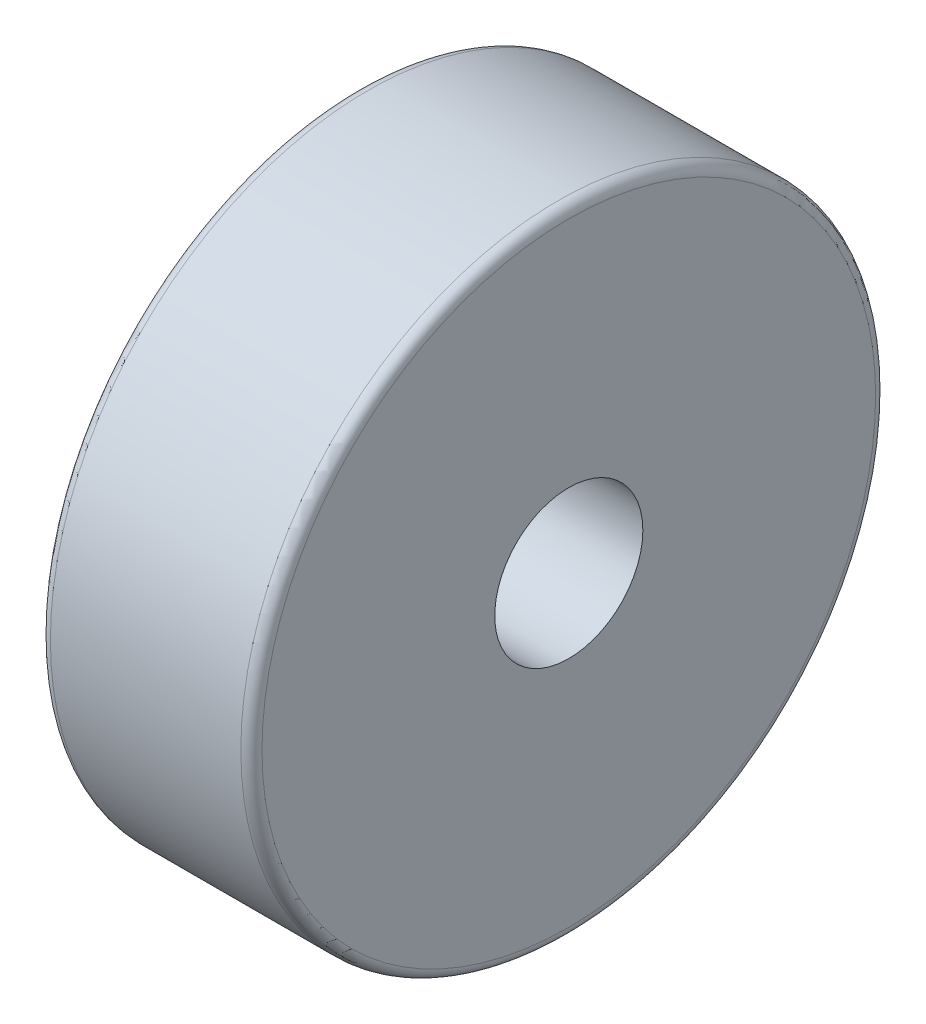
from build123d import *

# Parameters (mm, degrees)
SKETCH2_R           = 150
BOSS_EXTRUDE2_DEPTH = 100
SKETCH1_R           = 35
BOSS_EXTRUDE1_DEPTH = 60
FILLET1_R           = 5
CUT_EXTRUDE4_DEPTH  = 30
CIRPATTERN2_COUNT   = 4
SKETCH8_R           = 35
CUT_EXTRUDE5_DEPTH  = 266.706605172
SKETCH9_R           = 50
CUT_EXTRUDE6_DEPTH  = 30


with BuildPart() as part:
    # Sketch2 → Boss-Extrude2 (new body)
    with BuildSketch(Plane(origin=(0, 0, 0), x_dir=(0, 0, -1), z_dir=(1, 0, 0))):
        with Locations(Location((0, 0, 0), (0, 0, 180))):
            Circle(SKETCH2_R)
    extrude(amount=BOSS_EXTRUDE2_DEPTH)

    # Sketch1 → Boss-Extrude1 (add)
    with BuildSketch(Plane(origin=(100, 0, 0), x_dir=(0, 0, -1), z_dir=(1, 0, 0))):
        Circle(SKETCH1_R)
    extrude(amount=BOSS_EXTRUDE1_DEPTH)

    # Fillet1
    fillet1_edges = [part.edges().sort_by_distance(p)[0] for p in [
        (0, 0, -150),
        (100, 0, -150),
    ]]
    fillet(fillet1_edges, radius=FILLET1_R)

    # Sketch7 → Cut-Extrude4 (cut)
    with BuildSketch(Plane.ZY):
        with BuildLine():
            Line((-20, 128.452325787), (-20, 20))
            Line((-20, 20), (-128.452325787, 20))
            ThreePointArc((-128.452325787, 20), (-91.923881554, 91.923881554), (-20, 128.452325787))
        make_face()
    cut_extrude4 = extrude(amount=-CUT_EXTRUDE4_DEPTH, mode=Mode.SUBTRACT)

    # CirPattern2: Cut-Extrude4 ×4 about axis
    cirpattern2_axis = Axis((0, 0, 0), (1, 0, 0))
    for i in range(1, CIRPATTERN2_COUNT):
        add(cut_extrude4.rotate(cirpattern2_axis, i * 360 / CIRPATTERN2_COUNT), mode=Mode.SUBTRACT)

    # Sketch8 → Cut-Extrude5 (cut, through all)
    with BuildSketch(Plane(origin=(160, 0, 0), x_dir=(0, 0, -1), z_dir=(1, 0, 0))):
        Circle(SKETCH8_R)
    extrude(amount=-CUT_EXTRUDE5_DEPTH, mode=Mode.SUBTRACT)

    # Sketch9 → Cut-Extrude6 (cut)
    with BuildSketch(Plane.ZY):
        Circle(SKETCH9_R)
    extrude(amount=-CUT_EXTRUDE6_DEPTH, mode=Mode.SUBTRACT)


solid = part.part
